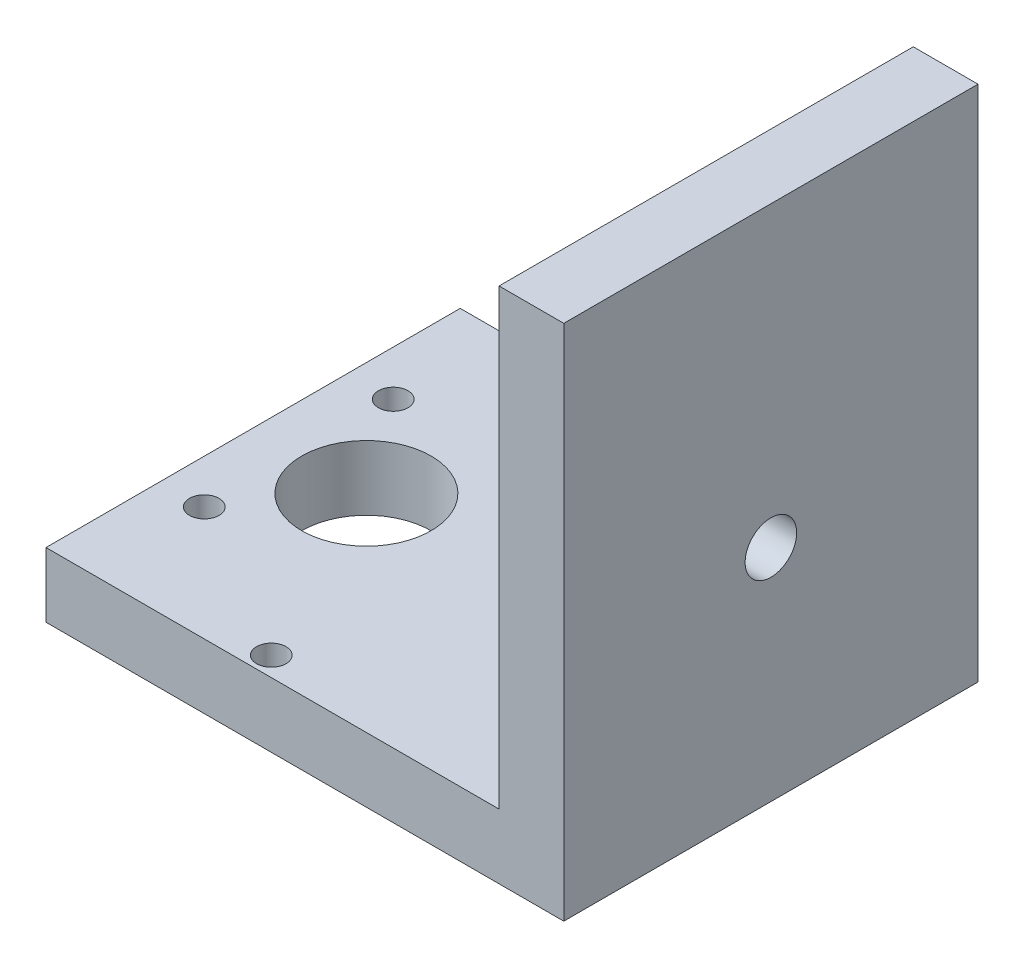
from build123d import *

# Parameters (mm, degrees)
BOSS_EXTRUDE1_DEPTH           = 40.64
F_8_0_199_DIAMETER_HOLE1_D    = 5.0546
SKETCH7_R                     = 6.35
CUT_EXTRUDE1_DEPTH            = 40.64
TAP_DRILL_FOR_M3_5X0_6_TAP1_D = 2.9


with BuildPart() as part:
    # Sketch4 → Boss-Extrude1 (new body)
    with BuildSketch(Plane.XY):
        Polygon((14.300746269, 21.994029851), (20.650746269, 21.994029851), (20.650746269, -28.805970149), (9.223880597, -28.805970149), (-30.149253731, -28.805970149), (-30.149253731, -22.455970149), (14.300746269, -22.455970149), align=None)
    extrude(amount=BOSS_EXTRUDE1_DEPTH)

    # #8 (0.199) Diameter Hole1 (through all)
    with Locations(Plane(origin=(20.650746269, 0, 0), x_dir=(0, 0, -1), z_dir=(1, 0, 0))):
        with Locations((-20.32, -7.215970149)):
            Hole(F_8_0_199_DIAMETER_HOLE1_D / 2)

    # Sketch7 → Cut-Extrude1 (cut)
    with BuildSketch(Plane(origin=(0, -22.455970149, 0), x_dir=(1, 0, 0), z_dir=(0, 1, 0))):
        with Locations(Location((-19.033752527, -20.32, 0), (0, 0, 180))):
            Circle(SKETCH7_R)
    extrude(amount=-CUT_EXTRUDE1_DEPTH, mode=Mode.SUBTRACT)

    # Tap Drill for M3.5x0.6 Tap1 (through all)
    with Locations(Plane(origin=(0, -22.455970149, 0), x_dir=(1, 0, 0), z_dir=(0, 1, 0))):
        with Locations((-25.715782321, -11.007082392), (-25.837741258, -29.421678533), (-9.951212668, -38.73459614), (-9.707294794, -1.90540386), (6.179233795, -11.218321467), (6.057274858, -29.632917608)):
            Hole(TAP_DRILL_FOR_M3_5X0_6_TAP1_D / 2)


solid = part.part
